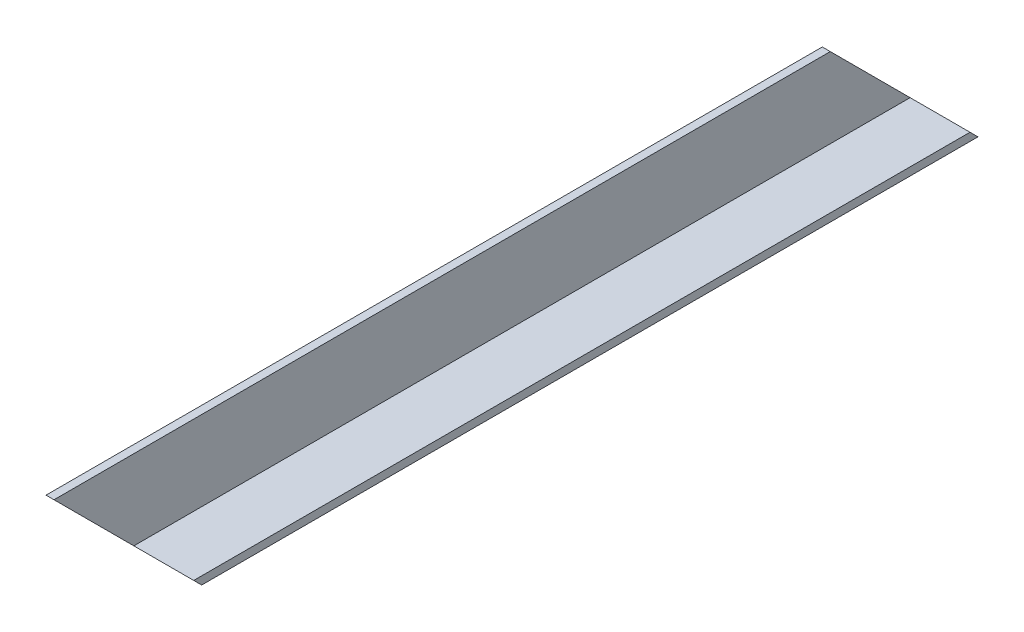
from build123d import *

# Parameters (mm, degrees)
BOSS_EXTRUDE1_DEPTH = 250
CUT_EXTRUDE1_DEPTH  = 150


with BuildPart() as part:
    # Sketch1 → Boss-Extrude1 (new body)
    with BuildSketch(Plane.XY):
        Polygon((0, 0), (0, 22), (2, 22), (2, 2), (17, 2), (17, 0), align=None)
    extrude(amount=BOSS_EXTRUDE1_DEPTH)

    # Sketch2 → Cut-Extrude1 (cut)
    with BuildSketch(Plane(origin=(17, 0, 0), x_dir=(0, 0, -1), z_dir=(1, 0, 0))):
        Polygon((-216.454364826, 22), (-250, 22), (-250, 0), (-194.454364826, 0), align=None)
        Polygon((-22, 22), (0, 22), (0, 0), align=None)
    extrude(amount=-CUT_EXTRUDE1_DEPTH, mode=Mode.SUBTRACT)


solid = part.part
